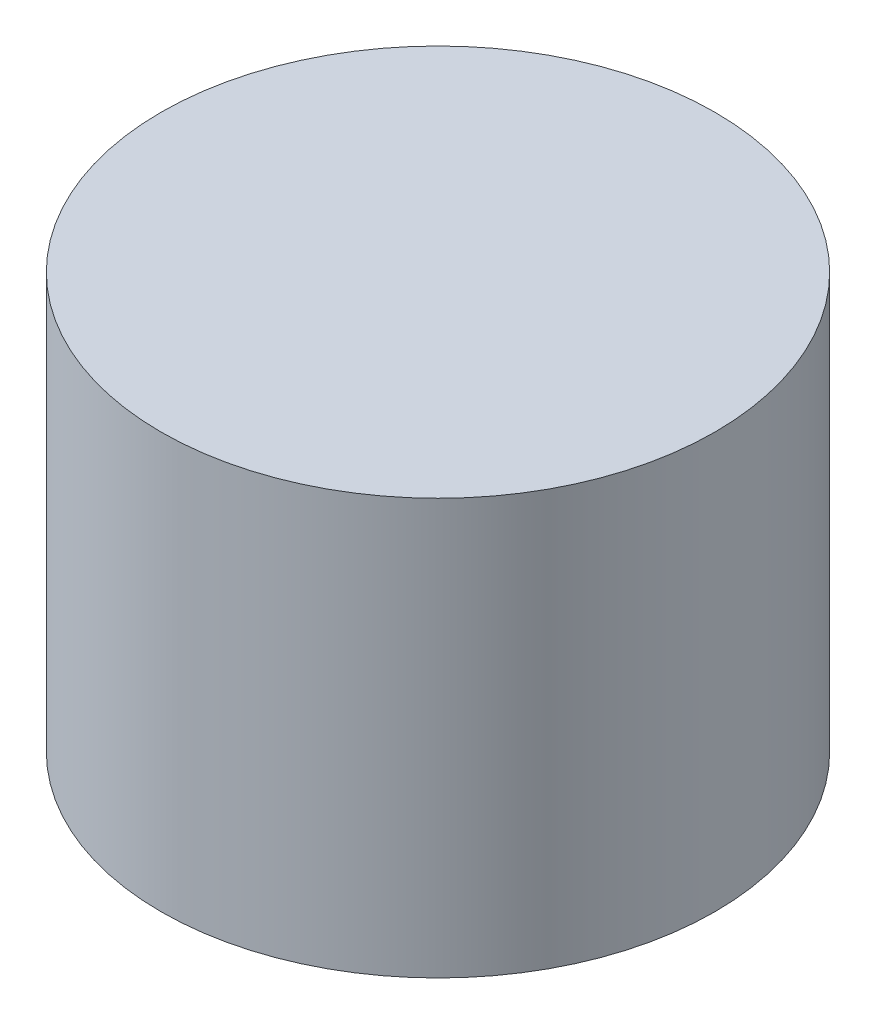
from build123d import *

# Parameters (mm, degrees)
SKETCH_1_R      = 40
EXTRUDE_1_DEPTH = 60


with BuildPart() as part:
    # 草图1 → 凸台-拉伸1 (new body)
    with BuildSketch(Plane(origin=(0, 0, 0), x_dir=(1, 0, 0), z_dir=(0, 1, 0))):
        with Locations(Location((0, 0, 0), (0, 0, 270))):
            Circle(SKETCH_1_R)
    extrude(amount=EXTRUDE_1_DEPTH)


solid = part.part
